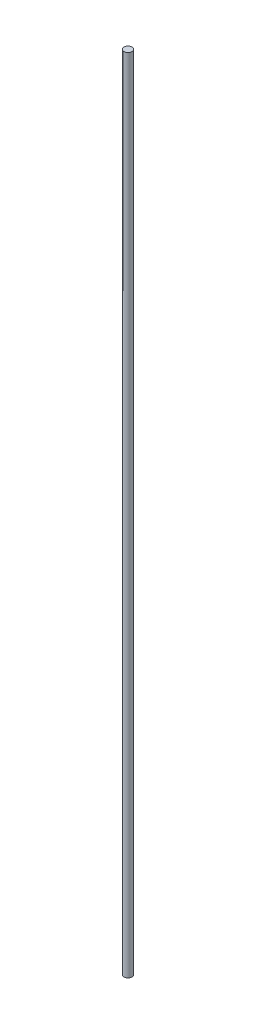
from build123d import *

# Parameters (mm, degrees)
SKETCH1_R           = 5
BOSS_EXTRUDE1_DEPTH = 1000


with BuildPart() as part:
    # Sketch1 → Boss-Extrude1 (new body)
    with BuildSketch(Plane(origin=(0, 0, 0), x_dir=(1, 0, 0), z_dir=(0, 1, 0))):
        with Locations(Location((0, 0, 0), (0, 0, 270))):
            Circle(SKETCH1_R)
    extrude(amount=BOSS_EXTRUDE1_DEPTH)


solid = part.part
